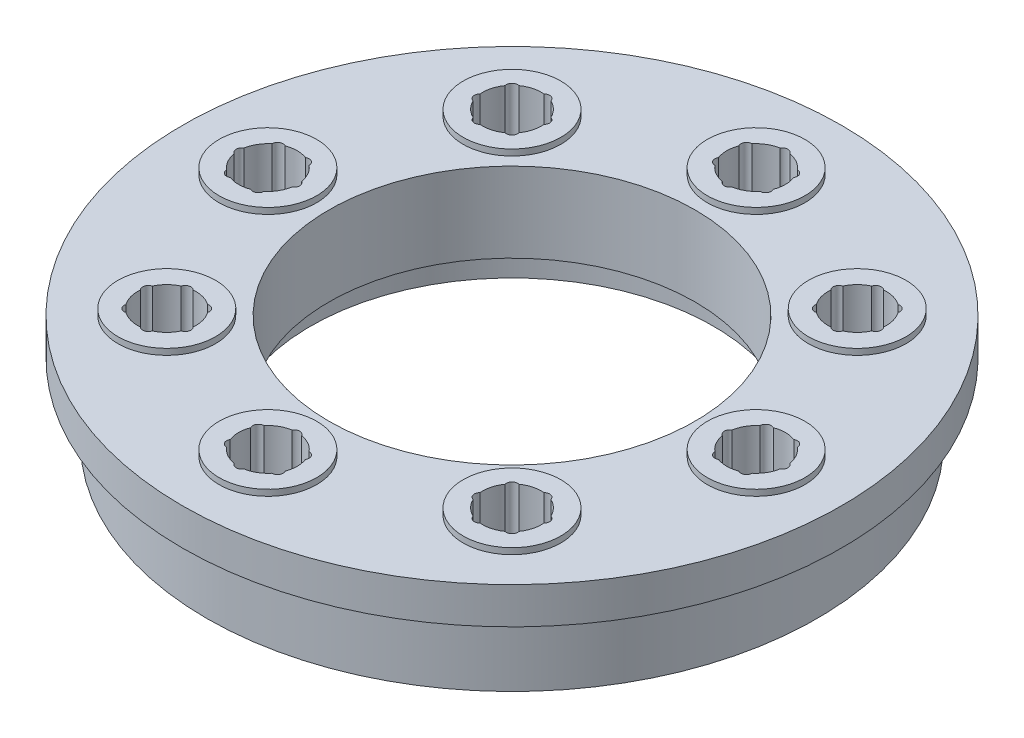
from build123d import *

# Parameters (mm, degrees)
CUT_EXTRUDE1_DEPTH        = 7
CIRPATTERN2_COUNT         = 6
FILLET1_R                 = 0.2
CIRPATTERN1_COUNT         = 8
CIRPATTERN1_COPY_1_DEPTH  = 7
CIRPATTERN1_COPY_2_DEPTH  = 7
CIRPATTERN1_COPY_3_DEPTH  = 7
CIRPATTERN1_COPY_4_DEPTH  = 7
CIRPATTERN1_COPY_5_DEPTH  = 7
CIRPATTERN1_COPY_6_DEPTH  = 7
CIRPATTERN1_COPY_7_DEPTH  = 7
CIRPATTERN1_COPY_8_DEPTH  = 7
CIRPATTERN1_COPY_9_DEPTH  = 7
CIRPATTERN1_COPY_10_DEPTH = 7
CIRPATTERN1_COPY_11_DEPTH = 7
CIRPATTERN1_COPY_12_DEPTH = 7
CIRPATTERN1_COPY_13_DEPTH = 7
CIRPATTERN1_COPY_14_DEPTH = 7
CIRPATTERN1_COPY_15_DEPTH = 7
CIRPATTERN1_COPY_16_DEPTH = 7
CIRPATTERN1_COPY_17_DEPTH = 7
CIRPATTERN1_COPY_18_DEPTH = 7
CIRPATTERN1_COPY_19_DEPTH = 7
CIRPATTERN1_COPY_20_DEPTH = 7
CIRPATTERN1_COPY_21_DEPTH = 7
CIRPATTERN1_COPY_22_DEPTH = 7
CIRPATTERN1_COPY_23_DEPTH = 7
CIRPATTERN1_COPY_24_DEPTH = 7
CIRPATTERN1_COPY_25_DEPTH = 7
CIRPATTERN1_COPY_26_DEPTH = 7
CIRPATTERN1_COPY_27_DEPTH = 7
CIRPATTERN1_COPY_28_DEPTH = 7
CIRPATTERN1_COPY_29_DEPTH = 7
CIRPATTERN1_COPY_30_DEPTH = 7
CIRPATTERN1_COPY_31_DEPTH = 7
CIRPATTERN1_COPY_32_DEPTH = 7
CIRPATTERN1_COPY_33_DEPTH = 7
CIRPATTERN1_COPY_34_DEPTH = 7
CIRPATTERN1_COPY_35_DEPTH = 7
FILLET1_OF_CIRPATTERN1_R  = 0.2
SKETCH6_R                 = 4
BOSS_EXTRUDE2_DEPTH       = 0.5
CIRPATTERN5_COUNT         = 8


with BuildPart() as part:
    # Sketch1 → Revolve1 (revolve)
    with BuildSketch(Plane.XY, mode=Mode.PRIVATE) as revolve1_sk:
        Polygon((-16.5, -9), (-25, -9), (-25, -3), (-27, -3), (-27, 0), (-15, 0), (-15, -6.533974596), (-16.5, -7.4), align=None)
    revolve(revolve1_sk.sketch.rotate(Axis((0, 0, 0), (0, -1, 0)), 270), axis=Axis((0, 0, 0), (0, -1, 0)))

    # Sketch2 → Cut-Revolve1 (revolve, cut)
    with BuildSketch(Plane.XY):
        with BuildLine():
            Line((-20, -6.5), (-20, 0))
            Line((-20, 0), (-22.4, 0))
            Line((-22.4, 0), (-22.4, -5.5))
            Line((-22.4, -5.5), (-22.132050808, -6.5))
            ThreePointArc((-22.132050808, -6.5), (-21.094947561, -6.873327018), (-20, -7))
            Line((-20, -7), (-20, -6.5))
        make_face()
    cut_revolve1 = revolve(axis=Axis((-20, -6.5, 0), (0, -1, 0)), mode=Mode.SUBTRACT)

    # Sketch3 → Cut-Extrude1 (cut)
    with BuildSketch(Plane(origin=(0, 0, 0), x_dir=(1, 0, 0), z_dir=(0, 1, 0))):
        with BuildLine():
            Line((-22.366431913, 0.4), (-20, 0.1))
            Line((-20, 0.1), (-20, -0.1))
            Line((-20, -0.1), (-22.366431913, -0.4))
            ThreePointArc((-22.366431913, -0.4), (-22.6, 0), (-22.366431913, 0.4))
        make_face()
    cut_extrude1 = extrude(amount=-CUT_EXTRUDE1_DEPTH, mode=Mode.SUBTRACT)

    # CirPattern2: Cut-Extrude1 ×6 about axis
    cirpattern2_axis = Axis((-20, 0, 0), (0, 1, 0))
    for i in range(1, CIRPATTERN2_COUNT):
        add(cut_extrude1.rotate(cirpattern2_axis, i * 360 / CIRPATTERN2_COUNT), mode=Mode.SUBTRACT)

    # Fillet1
    fillet1_edges = [part.edges().sort_by_distance(p)[0] for p in [
        (-20.221937584, -6.996573867, -0.128135724),
        (-20, -6.996573867, -0.256271448),
        (-20.221937584, -6.996573867, 0.128135724),
        (-19.778062416, -6.996573867, -0.128135724),
        (-20, -6.996573867, 0.256271448),
        (-19.778062416, -6.996573867, 0.128135724),
    ]]
    fillet(fillet1_edges, radius=FILLET1_R)

    # CirPattern1: Cut-Revolve1, Cut-Extrude1 ×8 about axis
    cirpattern1_axis = Axis((0, 0, 0), (0, 1, 0))
    add([cut_revolve1.rotate(cirpattern1_axis, i * 360 / CIRPATTERN1_COUNT) for i in range(1, CIRPATTERN1_COUNT)], mode=Mode.SUBTRACT)
    add([cut_extrude1.rotate(cirpattern1_axis, i * 360 / CIRPATTERN1_COUNT) for i in range(1, CIRPATTERN1_COUNT)], mode=Mode.SUBTRACT)

    # CirPattern1 copy 1 sketch → CirPattern1 copy 1 (cut)
    with BuildSketch(Plane(origin=(-19.318516526, 0, -5.176380902), x_dir=(-0.25881904510252063, 0, -0.9659258262890684), z_dir=(0, 1, 0))):
        with BuildLine():
            Line((-22.366431913, 0.4), (-20, 0.1))
            Line((-20, 0.1), (-20, -0.1))
            Line((-20, -0.1), (-22.366431913, -0.4))
            ThreePointArc((-22.366431913, -0.4), (-22.6, 0), (-22.366431913, 0.4))
        make_face()
    extrude(amount=-CIRPATTERN1_COPY_1_DEPTH, mode=Mode.SUBTRACT)

    # CirPattern1 copy 2 sketch → CirPattern1 copy 2 (cut)
    with BuildSketch(Plane(origin=(-17.320508076, 0, 10), x_dir=(-0.8660254037844386, 0, -0.5000000000000001), z_dir=(0, 1, 0))):
        with BuildLine():
            Line((-22.366431913, 0.4), (-20, 0.1))
            Line((-20, 0.1), (-20, -0.1))
            Line((-20, -0.1), (-22.366431913, -0.4))
            ThreePointArc((-22.366431913, -0.4), (-22.6, 0), (-22.366431913, 0.4))
        make_face()
    extrude(amount=-CIRPATTERN1_COPY_2_DEPTH, mode=Mode.SUBTRACT)

    # CirPattern1 copy 3 sketch → CirPattern1 copy 3 (cut)
    with BuildSketch(Plane(origin=(-5.176380902, 0, 19.318516526), x_dir=(-0.9659258262890684, 0, 0.25881904510252063), z_dir=(0, 1, 0))):
        with BuildLine():
            Line((-22.366431913, 0.4), (-20, 0.1))
            Line((-20, 0.1), (-20, -0.1))
            Line((-20, -0.1), (-22.366431913, -0.4))
            ThreePointArc((-22.366431913, -0.4), (-22.6, 0), (-22.366431913, 0.4))
        make_face()
    extrude(amount=-CIRPATTERN1_COPY_3_DEPTH, mode=Mode.SUBTRACT)

    # CirPattern1 copy 4 sketch → CirPattern1 copy 4 (cut)
    with BuildSketch(Plane(origin=(10, 0, 17.320508076), x_dir=(-0.5000000000000002, 0, 0.8660254037844385), z_dir=(0, 1, 0))):
        with BuildLine():
            Line((-22.366431913, 0.4), (-20, 0.1))
            Line((-20, 0.1), (-20, -0.1))
            Line((-20, -0.1), (-22.366431913, -0.4))
            ThreePointArc((-22.366431913, -0.4), (-22.6, 0), (-22.366431913, 0.4))
        make_face()
    extrude(amount=-CIRPATTERN1_COPY_4_DEPTH, mode=Mode.SUBTRACT)

    # CirPattern1 copy 5 sketch → CirPattern1 copy 5 (cut)
    with BuildSketch(Plane(origin=(19.318516526, 0, 5.176380902), x_dir=(0.2588190451025206, 0, 0.9659258262890684), z_dir=(0, 1, 0))):
        with BuildLine():
            Line((-22.366431913, 0.4), (-20, 0.1))
            Line((-20, 0.1), (-20, -0.1))
            Line((-20, -0.1), (-22.366431913, -0.4))
            ThreePointArc((-22.366431913, -0.4), (-22.6, 0), (-22.366431913, 0.4))
        make_face()
    extrude(amount=-CIRPATTERN1_COPY_5_DEPTH, mode=Mode.SUBTRACT)

    # CirPattern1 copy 6 sketch → CirPattern1 copy 6 (cut)
    with BuildSketch(Plane(origin=(17.320508076, 0, -10), x_dir=(0.8660254037844385, 0, 0.5000000000000002), z_dir=(0, 1, 0))):
        with BuildLine():
            Line((-22.366431913, 0.4), (-20, 0.1))
            Line((-20, 0.1), (-20, -0.1))
            Line((-20, -0.1), (-22.366431913, -0.4))
            ThreePointArc((-22.366431913, -0.4), (-22.6, 0), (-22.366431913, 0.4))
        make_face()
    extrude(amount=-CIRPATTERN1_COPY_6_DEPTH, mode=Mode.SUBTRACT)

    # CirPattern1 copy 7 sketch → CirPattern1 copy 7 (cut)
    with BuildSketch(Plane(origin=(5.176380902, 0, -19.318516526), x_dir=(0.9659258262890683, 0, -0.25881904510252046), z_dir=(0, 1, 0))):
        with BuildLine():
            Line((-22.366431913, 0.4), (-20, 0.1))
            Line((-20, 0.1), (-20, -0.1))
            Line((-20, -0.1), (-22.366431913, -0.4))
            ThreePointArc((-22.366431913, -0.4), (-22.6, 0), (-22.366431913, 0.4))
        make_face()
    extrude(amount=-CIRPATTERN1_COPY_7_DEPTH, mode=Mode.SUBTRACT)

    # CirPattern1 copy 8 sketch → CirPattern1 copy 8 (cut)
    with BuildSketch(Plane(origin=(-33.46065215, 0, 8.965754722), x_dir=(-0.9659258262890681, 0, -0.258819045102521), z_dir=(0, 1, 0))):
        with BuildLine():
            Line((-22.366431913, 0.4), (-20, 0.1))
            Line((-20, 0.1), (-20, -0.1))
            Line((-20, -0.1), (-22.366431913, -0.4))
            ThreePointArc((-22.366431913, -0.4), (-22.6, 0), (-22.366431913, 0.4))
        make_face()
    extrude(amount=-CIRPATTERN1_COPY_8_DEPTH, mode=Mode.SUBTRACT)

    # CirPattern1 copy 9 sketch → CirPattern1 copy 9 (cut)
    with BuildSketch(Plane(origin=(-17.320508076, 0, 30), x_dir=(-0.8660254037844387, 0, 0.4999999999999997), z_dir=(0, 1, 0))):
        with BuildLine():
            Line((-22.366431913, 0.4), (-20, 0.1))
            Line((-20, 0.1), (-20, -0.1))
            Line((-20, -0.1), (-22.366431913, -0.4))
            ThreePointArc((-22.366431913, -0.4), (-22.6, 0), (-22.366431913, 0.4))
        make_face()
    extrude(amount=-CIRPATTERN1_COPY_9_DEPTH, mode=Mode.SUBTRACT)

    # CirPattern1 copy 10 sketch → CirPattern1 copy 10 (cut)
    with BuildSketch(Plane(origin=(8.965754722, 0, 33.46065215), x_dir=(-0.258819045102521, 0, 0.9659258262890681), z_dir=(0, 1, 0))):
        with BuildLine():
            Line((-22.366431913, 0.4), (-20, 0.1))
            Line((-20, 0.1), (-20, -0.1))
            Line((-20, -0.1), (-22.366431913, -0.4))
            ThreePointArc((-22.366431913, -0.4), (-22.6, 0), (-22.366431913, 0.4))
        make_face()
    extrude(amount=-CIRPATTERN1_COPY_10_DEPTH, mode=Mode.SUBTRACT)

    # CirPattern1 copy 11 sketch → CirPattern1 copy 11 (cut)
    with BuildSketch(Plane(origin=(30, 0, 17.320508076), x_dir=(0.49999999999999967, 0, 0.8660254037844388), z_dir=(0, 1, 0))):
        with BuildLine():
            Line((-22.366431913, 0.4), (-20, 0.1))
            Line((-20, 0.1), (-20, -0.1))
            Line((-20, -0.1), (-22.366431913, -0.4))
            ThreePointArc((-22.366431913, -0.4), (-22.6, 0), (-22.366431913, 0.4))
        make_face()
    extrude(amount=-CIRPATTERN1_COPY_11_DEPTH, mode=Mode.SUBTRACT)

    # CirPattern1 copy 12 sketch → CirPattern1 copy 12 (cut)
    with BuildSketch(Plane(origin=(33.46065215, 0, -8.965754722), x_dir=(0.9659258262890682, 0, 0.25881904510252113), z_dir=(0, 1, 0))):
        with BuildLine():
            Line((-22.366431913, 0.4), (-20, 0.1))
            Line((-20, 0.1), (-20, -0.1))
            Line((-20, -0.1), (-22.366431913, -0.4))
            ThreePointArc((-22.366431913, -0.4), (-22.6, 0), (-22.366431913, 0.4))
        make_face()
    extrude(amount=-CIRPATTERN1_COPY_12_DEPTH, mode=Mode.SUBTRACT)

    # CirPattern1 copy 13 sketch → CirPattern1 copy 13 (cut)
    with BuildSketch(Plane(origin=(17.320508076, 0, -30), x_dir=(0.8660254037844388, 0, -0.4999999999999996), z_dir=(0, 1, 0))):
        with BuildLine():
            Line((-22.366431913, 0.4), (-20, 0.1))
            Line((-20, 0.1), (-20, -0.1))
            Line((-20, -0.1), (-22.366431913, -0.4))
            ThreePointArc((-22.366431913, -0.4), (-22.6, 0), (-22.366431913, 0.4))
        make_face()
    extrude(amount=-CIRPATTERN1_COPY_13_DEPTH, mode=Mode.SUBTRACT)

    # CirPattern1 copy 14 sketch → CirPattern1 copy 14 (cut)
    with BuildSketch(Plane(origin=(-8.965754722, 0, -33.46065215), x_dir=(0.2588190451025212, 0, -0.9659258262890682), z_dir=(0, 1, 0))):
        with BuildLine():
            Line((-22.366431913, 0.4), (-20, 0.1))
            Line((-20, 0.1), (-20, -0.1))
            Line((-20, -0.1), (-22.366431913, -0.4))
            ThreePointArc((-22.366431913, -0.4), (-22.6, 0), (-22.366431913, 0.4))
        make_face()
    extrude(amount=-CIRPATTERN1_COPY_14_DEPTH, mode=Mode.SUBTRACT)

    # CirPattern1 copy 15 sketch → CirPattern1 copy 15 (cut)
    with BuildSketch(Plane(origin=(-28.284271247, 0, 28.284271247), x_dir=(-0.7071067811865477, 0, 0.7071067811865474), z_dir=(0, 1, 0))):
        with BuildLine():
            Line((-22.366431913, 0.4), (-20, 0.1))
            Line((-20, 0.1), (-20, -0.1))
            Line((-20, -0.1), (-22.366431913, -0.4))
            ThreePointArc((-22.366431913, -0.4), (-22.6, 0), (-22.366431913, 0.4))
        make_face()
    extrude(amount=-CIRPATTERN1_COPY_15_DEPTH, mode=Mode.SUBTRACT)

    # CirPattern1 copy 16 sketch → CirPattern1 copy 16 (cut)
    with BuildSketch(Plane(origin=(0, 0, 40), x_dir=(0, 0, 1), z_dir=(0, 1, 0))):
        with BuildLine():
            Line((-22.366431913, 0.4), (-20, 0.1))
            Line((-20, 0.1), (-20, -0.1))
            Line((-20, -0.1), (-22.366431913, -0.4))
            ThreePointArc((-22.366431913, -0.4), (-22.6, 0), (-22.366431913, 0.4))
        make_face()
    extrude(amount=-CIRPATTERN1_COPY_16_DEPTH, mode=Mode.SUBTRACT)

    # CirPattern1 copy 17 sketch → CirPattern1 copy 17 (cut)
    with BuildSketch(Plane(origin=(28.284271247, 0, 28.284271247), x_dir=(0.7071067811865474, 0, 0.7071067811865477), z_dir=(0, 1, 0))):
        with BuildLine():
            Line((-22.366431913, 0.4), (-20, 0.1))
            Line((-20, 0.1), (-20, -0.1))
            Line((-20, -0.1), (-22.366431913, -0.4))
            ThreePointArc((-22.366431913, -0.4), (-22.6, 0), (-22.366431913, 0.4))
        make_face()
    extrude(amount=-CIRPATTERN1_COPY_17_DEPTH, mode=Mode.SUBTRACT)

    # CirPattern1 copy 18 sketch → CirPattern1 copy 18 (cut)
    with BuildSketch(Plane(origin=(40, 0, 0), x_dir=(1, 0, 0), z_dir=(0, 1, 0))):
        with BuildLine():
            Line((-22.366431913, 0.4), (-20, 0.1))
            Line((-20, 0.1), (-20, -0.1))
            Line((-20, -0.1), (-22.366431913, -0.4))
            ThreePointArc((-22.366431913, -0.4), (-22.6, 0), (-22.366431913, 0.4))
        make_face()
    extrude(amount=-CIRPATTERN1_COPY_18_DEPTH, mode=Mode.SUBTRACT)

    # CirPattern1 copy 19 sketch → CirPattern1 copy 19 (cut)
    with BuildSketch(Plane(origin=(28.284271247, 0, -28.284271247), x_dir=(0.7071067811865478, 0, -0.7071067811865474), z_dir=(0, 1, 0))):
        with BuildLine():
            Line((-22.366431913, 0.4), (-20, 0.1))
            Line((-20, 0.1), (-20, -0.1))
            Line((-20, -0.1), (-22.366431913, -0.4))
            ThreePointArc((-22.366431913, -0.4), (-22.6, 0), (-22.366431913, 0.4))
        make_face()
    extrude(amount=-CIRPATTERN1_COPY_19_DEPTH, mode=Mode.SUBTRACT)

    # CirPattern1 copy 20 sketch → CirPattern1 copy 20 (cut)
    with BuildSketch(Plane(origin=(0, 0, -40), x_dir=(0, 0, -1), z_dir=(0, 1, 0))):
        with BuildLine():
            Line((-22.366431913, 0.4), (-20, 0.1))
            Line((-20, 0.1), (-20, -0.1))
            Line((-20, -0.1), (-22.366431913, -0.4))
            ThreePointArc((-22.366431913, -0.4), (-22.6, 0), (-22.366431913, 0.4))
        make_face()
    extrude(amount=-CIRPATTERN1_COPY_20_DEPTH, mode=Mode.SUBTRACT)

    # CirPattern1 copy 21 sketch → CirPattern1 copy 21 (cut)
    with BuildSketch(Plane(origin=(-28.284271247, 0, -28.284271247), x_dir=(-0.7071067811865472, 0, -0.7071067811865478), z_dir=(0, 1, 0))):
        with BuildLine():
            Line((-22.366431913, 0.4), (-20, 0.1))
            Line((-20, 0.1), (-20, -0.1))
            Line((-20, -0.1), (-22.366431913, -0.4))
            ThreePointArc((-22.366431913, -0.4), (-22.6, 0), (-22.366431913, 0.4))
        make_face()
    extrude(amount=-CIRPATTERN1_COPY_21_DEPTH, mode=Mode.SUBTRACT)

    # CirPattern1 copy 22 sketch → CirPattern1 copy 22 (cut)
    with BuildSketch(Plane(origin=(-8.965754722, 0, 33.46065215), x_dir=(0.25881904510252013, 0, 0.9659258262890684), z_dir=(0, 1, 0))):
        with BuildLine():
            Line((-22.366431913, 0.4), (-20, 0.1))
            Line((-20, 0.1), (-20, -0.1))
            Line((-20, -0.1), (-22.366431913, -0.4))
            ThreePointArc((-22.366431913, -0.4), (-22.6, 0), (-22.366431913, 0.4))
        make_face()
    extrude(amount=-CIRPATTERN1_COPY_22_DEPTH, mode=Mode.SUBTRACT)

    # CirPattern1 copy 23 sketch → CirPattern1 copy 23 (cut)
    with BuildSketch(Plane(origin=(17.320508076, 0, 30), x_dir=(0.8660254037844384, 0, 0.5000000000000004), z_dir=(0, 1, 0))):
        with BuildLine():
            Line((-22.366431913, 0.4), (-20, 0.1))
            Line((-20, 0.1), (-20, -0.1))
            Line((-20, -0.1), (-22.366431913, -0.4))
            ThreePointArc((-22.366431913, -0.4), (-22.6, 0), (-22.366431913, 0.4))
        make_face()
    extrude(amount=-CIRPATTERN1_COPY_23_DEPTH, mode=Mode.SUBTRACT)

    # CirPattern1 copy 24 sketch → CirPattern1 copy 24 (cut)
    with BuildSketch(Plane(origin=(33.46065215, 0, 8.965754722), x_dir=(0.9659258262890684, 0, -0.25881904510252013), z_dir=(0, 1, 0))):
        with BuildLine():
            Line((-22.366431913, 0.4), (-20, 0.1))
            Line((-20, 0.1), (-20, -0.1))
            Line((-20, -0.1), (-22.366431913, -0.4))
            ThreePointArc((-22.366431913, -0.4), (-22.6, 0), (-22.366431913, 0.4))
        make_face()
    extrude(amount=-CIRPATTERN1_COPY_24_DEPTH, mode=Mode.SUBTRACT)

    # CirPattern1 copy 25 sketch → CirPattern1 copy 25 (cut)
    with BuildSketch(Plane(origin=(30, 0, -17.320508076), x_dir=(0.5000000000000006, 0, -0.8660254037844383), z_dir=(0, 1, 0))):
        with BuildLine():
            Line((-22.366431913, 0.4), (-20, 0.1))
            Line((-20, 0.1), (-20, -0.1))
            Line((-20, -0.1), (-22.366431913, -0.4))
            ThreePointArc((-22.366431913, -0.4), (-22.6, 0), (-22.366431913, 0.4))
        make_face()
    extrude(amount=-CIRPATTERN1_COPY_25_DEPTH, mode=Mode.SUBTRACT)

    # CirPattern1 copy 26 sketch → CirPattern1 copy 26 (cut)
    with BuildSketch(Plane(origin=(8.965754722, 0, -33.46065215), x_dir=(-0.2588190451025201, 0, -0.9659258262890685), z_dir=(0, 1, 0))):
        with BuildLine():
            Line((-22.366431913, 0.4), (-20, 0.1))
            Line((-20, 0.1), (-20, -0.1))
            Line((-20, -0.1), (-22.366431913, -0.4))
            ThreePointArc((-22.366431913, -0.4), (-22.6, 0), (-22.366431913, 0.4))
        make_face()
    extrude(amount=-CIRPATTERN1_COPY_26_DEPTH, mode=Mode.SUBTRACT)

    # CirPattern1 copy 27 sketch → CirPattern1 copy 27 (cut)
    with BuildSketch(Plane(origin=(-17.320508076, 0, -30), x_dir=(-0.8660254037844383, 0, -0.5000000000000006), z_dir=(0, 1, 0))):
        with BuildLine():
            Line((-22.366431913, 0.4), (-20, 0.1))
            Line((-20, 0.1), (-20, -0.1))
            Line((-20, -0.1), (-22.366431913, -0.4))
            ThreePointArc((-22.366431913, -0.4), (-22.6, 0), (-22.366431913, 0.4))
        make_face()
    extrude(amount=-CIRPATTERN1_COPY_27_DEPTH, mode=Mode.SUBTRACT)

    # CirPattern1 copy 28 sketch → CirPattern1 copy 28 (cut)
    with BuildSketch(Plane(origin=(-33.46065215, 0, -8.965754722), x_dir=(-0.9659258262890684, 0, 0.25881904510251996), z_dir=(0, 1, 0))):
        with BuildLine():
            Line((-22.366431913, 0.4), (-20, 0.1))
            Line((-20, 0.1), (-20, -0.1))
            Line((-20, -0.1), (-22.366431913, -0.4))
            ThreePointArc((-22.366431913, -0.4), (-22.6, 0), (-22.366431913, 0.4))
        make_face()
    extrude(amount=-CIRPATTERN1_COPY_28_DEPTH, mode=Mode.SUBTRACT)

    # CirPattern1 copy 29 sketch → CirPattern1 copy 29 (cut)
    with BuildSketch(Plane(origin=(5.176380902, 0, 19.318516526), x_dir=(0.9659258262890683, 0, 0.2588190451025208), z_dir=(0, 1, 0))):
        with BuildLine():
            Line((-22.366431913, 0.4), (-20, 0.1))
            Line((-20, 0.1), (-20, -0.1))
            Line((-20, -0.1), (-22.366431913, -0.4))
            ThreePointArc((-22.366431913, -0.4), (-22.6, 0), (-22.366431913, 0.4))
        make_face()
    extrude(amount=-CIRPATTERN1_COPY_29_DEPTH, mode=Mode.SUBTRACT)

    # CirPattern1 copy 30 sketch → CirPattern1 copy 30 (cut)
    with BuildSketch(Plane(origin=(17.320508076, 0, 10), x_dir=(0.8660254037844386, 0, -0.5000000000000001), z_dir=(0, 1, 0))):
        with BuildLine():
            Line((-22.366431913, 0.4), (-20, 0.1))
            Line((-20, 0.1), (-20, -0.1))
            Line((-20, -0.1), (-22.366431913, -0.4))
            ThreePointArc((-22.366431913, -0.4), (-22.6, 0), (-22.366431913, 0.4))
        make_face()
    extrude(amount=-CIRPATTERN1_COPY_30_DEPTH, mode=Mode.SUBTRACT)

    # CirPattern1 copy 31 sketch → CirPattern1 copy 31 (cut)
    with BuildSketch(Plane(origin=(19.318516526, 0, -5.176380902), x_dir=(0.2588190451025208, 0, -0.9659258262890683), z_dir=(0, 1, 0))):
        with BuildLine():
            Line((-22.366431913, 0.4), (-20, 0.1))
            Line((-20, 0.1), (-20, -0.1))
            Line((-20, -0.1), (-22.366431913, -0.4))
            ThreePointArc((-22.366431913, -0.4), (-22.6, 0), (-22.366431913, 0.4))
        make_face()
    extrude(amount=-CIRPATTERN1_COPY_31_DEPTH, mode=Mode.SUBTRACT)

    # CirPattern1 copy 32 sketch → CirPattern1 copy 32 (cut)
    with BuildSketch(Plane(origin=(10, 0, -17.320508076), x_dir=(-0.5, 0, -0.8660254037844387), z_dir=(0, 1, 0))):
        with BuildLine():
            Line((-22.366431913, 0.4), (-20, 0.1))
            Line((-20, 0.1), (-20, -0.1))
            Line((-20, -0.1), (-22.366431913, -0.4))
            ThreePointArc((-22.366431913, -0.4), (-22.6, 0), (-22.366431913, 0.4))
        make_face()
    extrude(amount=-CIRPATTERN1_COPY_32_DEPTH, mode=Mode.SUBTRACT)

    # CirPattern1 copy 33 sketch → CirPattern1 copy 33 (cut)
    with BuildSketch(Plane(origin=(-5.176380902, 0, -19.318516526), x_dir=(-0.9659258262890684, 0, -0.2588190451025208), z_dir=(0, 1, 0))):
        with BuildLine():
            Line((-22.366431913, 0.4), (-20, 0.1))
            Line((-20, 0.1), (-20, -0.1))
            Line((-20, -0.1), (-22.366431913, -0.4))
            ThreePointArc((-22.366431913, -0.4), (-22.6, 0), (-22.366431913, 0.4))
        make_face()
    extrude(amount=-CIRPATTERN1_COPY_33_DEPTH, mode=Mode.SUBTRACT)

    # CirPattern1 copy 34 sketch → CirPattern1 copy 34 (cut)
    with BuildSketch(Plane(origin=(-17.320508076, 0, -10), x_dir=(-0.8660254037844387, 0, 0.49999999999999994), z_dir=(0, 1, 0))):
        with BuildLine():
            Line((-22.366431913, 0.4), (-20, 0.1))
            Line((-20, 0.1), (-20, -0.1))
            Line((-20, -0.1), (-22.366431913, -0.4))
            ThreePointArc((-22.366431913, -0.4), (-22.6, 0), (-22.366431913, 0.4))
        make_face()
    extrude(amount=-CIRPATTERN1_COPY_34_DEPTH, mode=Mode.SUBTRACT)

    # CirPattern1 copy 35 sketch → CirPattern1 copy 35 (cut)
    with BuildSketch(Plane(origin=(-19.318516526, 0, 5.176380902), x_dir=(-0.25881904510252085, 0, 0.9659258262890682), z_dir=(0, 1, 0))):
        with BuildLine():
            Line((-22.366431913, 0.4), (-20, 0.1))
            Line((-20, 0.1), (-20, -0.1))
            Line((-20, -0.1), (-22.366431913, -0.4))
            ThreePointArc((-22.366431913, -0.4), (-22.6, 0), (-22.366431913, 0.4))
        make_face()
    extrude(amount=-CIRPATTERN1_COPY_35_DEPTH, mode=Mode.SUBTRACT)

    # Fillet1 of CirPattern1
    fillet1_of_cirpattern1_edges = [part.edges().sort_by_distance(p)[0] for p in [
        (-14.389674834, -6.996573867, 14.208463555),
        (-14.323346903, -6.996573867, 13.960924345),
        (-14.208463555, -6.996573867, 14.389674834),
        (-14.075807692, -6.996573867, 13.894596413),
        (-13.960924345, -6.996573867, 14.323346903),
        (-13.894596413, -6.996573867, 14.075807692),
        (-0.128135724, -6.996573867, 20.221937584),
        (-0.256271448, -6.996573867, 20),
        (0.128135724, -6.996573867, 20.221937584),
        (-0.128135724, -6.996573867, 19.778062416),
        (0.256271448, -6.996573867, 20),
        (0.128135724, -6.996573867, 19.778062416),
        (14.208463555, -6.996573867, 14.389674834),
        (13.960924345, -6.996573867, 14.323346903),
        (14.389674834, -6.996573867, 14.208463555),
        (13.894596413, -6.996573867, 14.075807692),
        (14.323346903, -6.996573867, 13.960924345),
        (14.075807692, -6.996573867, 13.894596413),
        (20.221937584, -6.996573867, 0.128135724),
        (20, -6.996573867, 0.256271448),
        (20.221937584, -6.996573867, -0.128135724),
        (19.778062416, -6.996573867, 0.128135724),
        (20, -6.996573867, -0.256271448),
        (19.778062416, -6.996573867, -0.128135724),
        (14.389674834, -6.996573867, -14.208463555),
        (14.323346903, -6.996573867, -13.960924345),
        (14.208463555, -6.996573867, -14.389674834),
        (14.075807692, -6.996573867, -13.894596413),
        (13.960924345, -6.996573867, -14.323346903),
        (13.894596413, -6.996573867, -14.075807692),
        (0.128135724, -6.996573867, -20.221937584),
        (0.256271448, -6.996573867, -20),
        (-0.128135724, -6.996573867, -20.221937584),
        (0.128135724, -6.996573867, -19.778062416),
        (-0.256271448, -6.996573867, -20),
        (-0.128135724, -6.996573867, -19.778062416),
        (-14.208463555, -6.996573867, -14.389674834),
        (-13.960924345, -6.996573867, -14.323346903),
        (-14.389674834, -6.996573867, -14.208463555),
        (-13.894596413, -6.996573867, -14.075807692),
        (-14.323346903, -6.996573867, -13.960924345),
        (-14.075807692, -6.996573867, -13.894596413),
    ]]
    fillet(fillet1_of_cirpattern1_edges, radius=FILLET1_OF_CIRPATTERN1_R)

    # Sketch6 → Boss-Extrude2 (add)
    with BuildSketch(Plane(origin=(0, 0, 0), x_dir=(1, 0, 0), z_dir=(0, 1, 0))):
        with Locations(Location((-20, 0, 0), (0, 0, 270))):
            Circle(SKETCH6_R)
        with BuildLine():
            ThreePointArc((-18.470373882, 1.849390153), (-18.7, 2.25166605), (-19.163194205, 2.249390153))
            ThreePointArc((-19.163194205, 2.249390153), (-20, 2.4), (-20.836805795, 2.249390153))
            ThreePointArc((-20.836805795, 2.249390153), (-21.3, 2.25166605), (-21.529626118, 1.849390153))
            ThreePointArc((-21.529626118, 1.849390153), (-22.078460969, 1.2), (-22.366431913, 0.4))
            ThreePointArc((-22.366431913, 0.4), (-22.6, 0), (-22.366431913, -0.4))
            ThreePointArc((-22.366431913, -0.4), (-22.078460969, -1.2), (-21.529626118, -1.849390153))
            ThreePointArc((-21.529626118, -1.849390153), (-21.3, -2.25166605), (-20.836805795, -2.249390153))
            ThreePointArc((-20.836805795, -2.249390153), (-20, -2.4), (-19.163194205, -2.249390153))
            ThreePointArc((-19.163194205, -2.249390153), (-18.7, -2.25166605), (-18.470373882, -1.849390153))
            ThreePointArc((-18.470373882, -1.849390153), (-17.921539031, -1.2), (-17.633568087, -0.4))
            ThreePointArc((-17.633568087, -0.4), (-17.4, 0), (-17.633568087, 0.4))
            ThreePointArc((-17.633568087, 0.4), (-17.921539031, 1.2), (-18.470373882, 1.849390153))
        make_face(mode=Mode.SUBTRACT)
    boss_extrude2 = extrude(amount=BOSS_EXTRUDE2_DEPTH)

    # CirPattern5: Boss-Extrude2 ×8 about axis
    cirpattern5_axis = Axis((0, 0, 0), (0, 1, 0))
    for i in range(1, CIRPATTERN5_COUNT):
        add(boss_extrude2.rotate(cirpattern5_axis, i * 360 / CIRPATTERN5_COUNT))


solid = part.part
